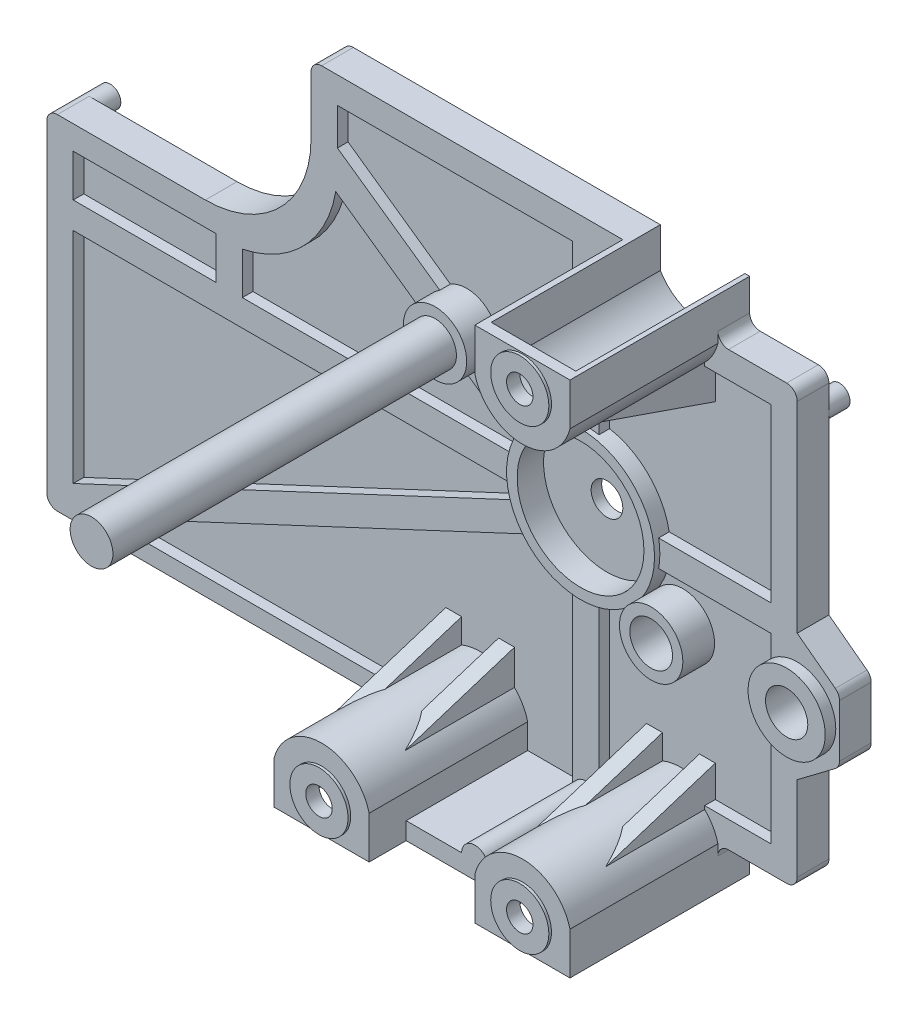
from build123d import *
from build123d.topology import SkipClean

# Parameters (mm, degrees)
SALIENTE_EXTRUIR1_DEPTH     = 3
SALIENTE_EXTRUIR2_DEPTH     = 28
SALIENTE_EXTRUIR3_DEPTH     = 21
CORTAR_EXTRUIR1_START       = -2
CROQUIS7_W                  = 27
CROQUIS7_H                  = 8
CORTAR_EXTRUIR1_DEPTH       = 2
CROQUIS8_R                  = 14
CROQUIS8_R_2                = 12
SALIENTE_EXTRUIR4_DEPTH     = 1
CORTAR_EXTRUIR2_DEPTH       = 39
CORTAR_EXTRUIR2_DEPTH_BACK  = 37
CROQUIS9_R                  = 3
CROQUIS10_R                 = 12
CROQUIS10_R_2               = 3
CORTAR_EXTRUIR3_DEPTH       = 4
SALIENTE_EXTRUIR7_DEPTH     = 1.5
SALIENTE_EXTRUIR8_DEPTH     = 1.5
SALIENTE_EXTRUIR9_DEPTH     = 1.5
SALIENTE_EXTRUIR10_DEPTH    = 1.5
SALIENTE_EXTRUIR11_DEPTH    = 1.5
SALIENTE_EXTRUIR12_DEPTH    = 1.5
CROQUIS22_R                 = 6
CROQUIS22_R_2               = 4.05
SALIENTE_EXTRUIR15_DEPTH    = 6
SALIENTE_EXTRUIR15_2_DEPTH  = 6
CORTAR_EXTRUIR6_DEPTH       = 22
CORTAR_EXTRUIR6_DEPTH_BACK  = 17
CROQUIS23_R                 = 4.05
CROQUIS24_R                 = 5.5
SALIENTE_EXTRUIR16_DEPTH    = 0.5
CROQUIS25_R                 = 2.5
CORTAR_EXTRUIR7_DEPTH       = 40.5
SALIENTE_EXTRUIR17_DEPTH    = 3.282447
CORTAR_EXTRUIR8_DEPTH       = 32
CORTAR_EXTRUIR9_DEPTH       = 32
CORTAR_EXTRUIR10_DEPTH      = 32
SALIENTE_EXTRUIR18_DEPTH    = 4
CROQUIS33_R                 = 0.75
CORTAR_EXTRUIR11_DEPTH      = 4
CROQUIS34_R                 = 2
SALIENTE_EXTRUIR19_DEPTH    = 4
CROQUIS35_R                 = 1
CORTAR_EXTRUIR12_DEPTH      = 3.5
CROQUIS36_R                 = 0.8
SALIENTE_EXTRUIR20_DEPTH    = 0.2
C_PULA1_FACE_RADIUS         = 0.8
C_PULA1_HEIGHT              = 1
CROQUIS39_R                 = 7.3
SALIENTE_EXTRUIR21_DEPTH    = 4
CORTAR_EXTRUIR13_DEPTH      = 26
CORTAR_EXTRUIR13_DEPTH_BACK = 38
CROQUIS40_R                 = 4
CROQUIS42_R                 = 4.05
SALIENTE_EXTRUIR24_DEPTH    = 65


with BuildPart() as part:
    # Croquis3 → Saliente-Extruir1 (new, symmetric)
    with BuildSketch(Plane.XY):
        with BuildLine():
            Line((48.723300971, -56.222087379), (48.723300971, -50.222087379))
            ThreePointArc((48.723300971, -50.222087379), (49.309087409, -48.807873816), (50.723300971, -48.222087379))
            Line((50.723300971, -48.222087379), (61.723300971, -48.222087379))
            ThreePointArc((61.723300971, -48.222087379), (63.137514533, -47.636300941), (63.723300971, -46.222087379))
            Line((63.723300971, -46.222087379), (63.723300971, -30.222087379))
            Line((63.723300971, -30.222087379), (70.926931017, -24.793762782))
            ThreePointArc((70.926931017, -24.793762782), (71.513169694, -24.088887388), (71.723300971, -23.196491762))
            Line((71.723300971, -23.196491762), (71.723300971, -13.247682996))
            ThreePointArc((71.723300971, -13.247682996), (71.513169694, -12.355287369), (70.926931017, -11.650411975))
            Line((70.926931017, -11.650411975), (63.723300971, -6.222087379))
            Line((63.723300971, -6.222087379), (63.723300971, 31.777912621))
            ThreePointArc((63.723300971, 31.777912621), (63.137514533, 33.192126184), (61.723300971, 33.777912621))
            Line((61.723300971, 33.777912621), (50.723300971, 33.777912621))
            ThreePointArc((50.723300971, 33.777912621), (49.309087409, 34.363699059), (48.723300971, 35.777912621))
            Line((48.723300971, 35.777912621), (48.723300971, 41.777912621))
            Line((48.723300971, 41.777912621), (-26.276699029, 41.777912621))
            ThreePointArc((-26.276699029, 41.777912621), (-27.690912591, 41.192126184), (-28.276699029, 39.777912621))
            Line((-28.276699029, 39.777912621), (-28.276699029, 28.777912621))
            ThreePointArc((-28.276699029, 28.777912621), (-34.134563405, 14.635776998), (-48.276699029, 8.777912621))
            Line((-48.276699029, 8.777912621), (-76.276699029, 8.777912621))
            ThreePointArc((-76.276699029, 8.777912621), (-77.690912591, 8.192126184), (-78.276699029, 6.777912621))
            Line((-78.276699029, 6.777912621), (-78.276699029, -54.222087379))
            ThreePointArc((-78.276699029, -54.222087379), (-77.690912591, -55.636300941), (-76.276699029, -56.222087379))
            Line((-76.276699029, -56.222087379), (48.723300971, -56.222087379))
        make_face()
    extrude(amount=SALIENTE_EXTRUIR1_DEPTH, both=True)

    # Croquis4 → Saliente-Extruir2 (add)
    with BuildSketch(Plane.XY.offset(3)):
        with BuildLine():
            Line((30.723300971, 41.777912621), (30.723300971, 33.777912621))
            ThreePointArc((30.723300971, 33.777912621), (39.723300971, 26.76030074), (48.723300971, 33.777912621))
            Line((48.723300971, 33.777912621), (48.723300971, 41.777912621))
            Line((48.723300971, 41.777912621), (30.723300971, 41.777912621))
        make_face()
        with BuildLine():
            Line((48.723300971, -56.222087379), (48.723300971, -48.222087379))
            ThreePointArc((48.723300971, -48.222087379), (39.723300971, -41.204475497), (30.723300971, -48.222087379))
            Line((30.723300971, -48.222087379), (30.723300971, -56.222087379))
            Line((30.723300971, -56.222087379), (48.723300971, -56.222087379))
        make_face()
        with BuildLine():
            Line((10.723300971, -56.222087379), (10.723300971, -48.222087379))
            ThreePointArc((10.723300971, -48.222087379), (1.723300971, -41.204475497), (-7.276699029, -48.222087379))
            Line((-7.276699029, -48.222087379), (-7.276699029, -56.222087379))
            Line((-7.276699029, -56.222087379), (10.723300971, -56.222087379))
        make_face()
    extrude(amount=SALIENTE_EXTRUIR2_DEPTH)

    # Croquis5 → Saliente-Extruir3 (add)
    with BuildSketch(Plane.XY.offset(3)):
        with BuildLine():
            Line((10.723300971, -56.222087379), (10.723300971, -52.939642318))
            Line((10.723300971, -52.939642318), (21.223300971, -52.939642318))
            ThreePointArc((21.223300971, -52.939642318), (23.723300971, -50.439642318), (26.223300971, -52.939642318))
            Line((26.223300971, -52.939642318), (30.723300971, -52.939642318))
            Line((30.723300971, -52.939642318), (30.723300971, -56.222087379))
            Line((30.723300971, -56.222087379), (10.723300971, -56.222087379))
        make_face()
    extrude(amount=SALIENTE_EXTRUIR3_DEPTH)

    # Croquis7 → Cortar-Extruir1 (cut)
    with BuildSketch(Plane.XY.offset(3).offset(CORTAR_EXTRUIR1_START)):
        with BuildLine():
            Line((-73.276699029, -8.722087379), (-73.276699029, -50.179501513))
            Line((-73.276699029, -50.179501513), (10.54826866, -10.956907714))
            ThreePointArc((10.54826866, -10.956907714), (10.202045105, -9.851913796), (9.948323657, -8.722087379))
            Line((9.948323657, -8.722087379), (-73.276699029, -8.722087379))
        make_face()
        with Locations((-59.776699029, 0.277912621)):
            Rectangle(CROQUIS7_W, CROQUIS7_H)
        with BuildLine():
            Line((-23.276699029, 36.777912621), (16.723300971, 36.777912621))
            Line((16.723300971, 36.777912621), (21.223300971, 36.777912621))
            Line((21.223300971, 36.777912621), (21.223300971, 7.552889935))
            ThreePointArc((21.223300971, 7.552889935), (17.239971214, 6.186233832), (13.843272479, 3.696835799))
            Line((13.843272479, 3.696835799), (-23.276699029, 29.796763611))
            Line((-23.276699029, 29.796763611), (-23.276699029, 36.777912621))
        make_face()
        with BuildLine():
            Line((-41.276699029, 4.232504936), (-41.276699029, -3.722087379))
            Line((-41.276699029, -3.722087379), (4.723442905, -3.722087379))
            Line((4.723442905, -3.722087379), (9.948323657, -3.722087379))
            ThreePointArc((9.948323657, -3.722087379), (10.200034776, -2.599757822), (10.543026708, -1.50187866))
            Line((10.543026708, -1.50187866), (-23.595805676, 22.501939894))
            ThreePointArc((-23.595805676, 22.501939894), (-29.60850244, 10.63056719), (-41.276699029, 4.232504936))
        make_face()
        with BuildLine():
            Line((26.223300971, 36.777912621), (26.223300971, 7.552889935))
            ThreePointArc((26.223300971, 7.552889935), (33.622795907, 3.677407558), (37.498278285, -3.722087379))
            Line((37.498278285, -3.722087379), (58.723300971, -3.722087379))
            Line((58.723300971, -3.722087379), (58.723300971, 28.777912621))
            Line((58.723300971, 28.777912621), (45.500507806, 28.777912621))
            ThreePointArc((45.500507806, 28.777912621), (36.748977696, 27.249862693), (30.723300971, 33.777912621))
            Line((30.723300971, 33.777912621), (30.723300971, 36.777912621))
            Line((30.723300971, 36.777912621), (26.223300971, 36.777912621))
        make_face()
        with BuildLine():
            Line((37.498278285, -8.722087379), (58.723300971, -8.722087379))
            Line((58.723300971, -8.722087379), (58.723300971, -43.222087379))
            Line((58.723300971, -43.222087379), (45.500507806, -43.222087379))
            ThreePointArc((45.500507806, -43.222087379), (36.748977696, -41.694037451), (30.723300971, -48.222087379))
            Line((30.723300971, -48.222087379), (30.723300971, -52.939642318))
            Line((30.723300971, -52.939642318), (26.223300971, -52.939642318))
            Line((26.223300971, -52.939642318), (26.223300971, -43.525335216))
            Line((26.223300971, -43.525335216), (26.223300971, -19.997064693))
            ThreePointArc((26.223300971, -19.997064693), (33.622795907, -16.121582315), (37.498278285, -8.722087379))
        make_face()
        with BuildLine():
            Line((21.223300971, -52.939642318), (21.223300971, -19.997064693))
            ThreePointArc((21.223300971, -19.997064693), (16.737476548, -18.354616263), (13.065010864, -15.299578882))
            Line((13.065010864, -15.299578882), (-67.377835865, -52.939642318))
            Line((-67.377835865, -52.939642318), (-7.276699029, -52.939642318))
            Line((-7.276699029, -52.939642318), (-7.276699029, -48.222087379))
            ThreePointArc((-7.276699029, -48.222087379), (1.723300971, -41.204475497), (10.723300971, -48.222087379))
            Line((10.723300971, -48.222087379), (10.723300971, -52.939642318))
            Line((10.723300971, -52.939642318), (21.223300971, -52.939642318))
        make_face()
    extrude(amount=CORTAR_EXTRUIR1_DEPTH, mode=Mode.SUBTRACT)

    # Croquis8 → Saliente-Extruir4 (add)
    with SkipClean():  # the faces are left unmerged after this step: merging them gives an invalid solid
        with BuildSketch(Plane.XY.offset(3)):
            with Locations((23.723300971, -6.222087379)):
                Circle(CROQUIS8_R)
            with Locations((23.723300971, -6.222087379)):
                Circle(CROQUIS8_R_2, mode=Mode.SUBTRACT)
        extrude(amount=SALIENTE_EXTRUIR4_DEPTH)

    # Croquis9 → Cortar-Extruir2 (cut, two sides: drawn at the far end of the back side and taken through both)
    with SkipClean():  # the faces are left unmerged after this step: merging them gives an invalid solid
        with BuildSketch(Plane.XY.offset(3).offset(-CORTAR_EXTRUIR2_DEPTH_BACK)):
            with Locations((23.723300971, -6.222087379)):
                Circle(CROQUIS9_R)
        extrude(amount=CORTAR_EXTRUIR2_DEPTH + CORTAR_EXTRUIR2_DEPTH_BACK, mode=Mode.SUBTRACT)

    # Croquis10 → Cortar-Extruir3 (cut)
    with SkipClean():  # the faces are left unmerged after this step: merging them gives an invalid solid
        with BuildSketch(Plane.XY.offset(3)):
            with Locations((23.723300971, -6.222087379)):
                Circle(CROQUIS10_R)
            with Locations((23.723300971, -6.222087379)):
                Circle(CROQUIS10_R_2, mode=Mode.SUBTRACT)
        extrude(amount=-CORTAR_EXTRUIR3_DEPTH, mode=Mode.SUBTRACT)

    # Croquis15 → Saliente-Extruir7 (add, symmetric)
    with SkipClean():  # the faces are left unmerged after this step: merging them gives an invalid solid
        with BuildSketch(Plane.ZY.offset(3.276699029)):
            Polygon((25.08, -44.936835027), (3, -44.936835027), (0, -44.936835027), (0, -36.936835027), align=None)
        extrude(amount=SALIENTE_EXTRUIR7_DEPTH, both=True)

    # Croquis17 → Saliente-Extruir8 (add, symmetric)
    with SkipClean():  # the faces are left unmerged after this step: merging them gives an invalid solid
        with BuildSketch(Plane(origin=(6.723300971, 0, 0), x_dir=(0, 0, -1), z_dir=(1, 0, 0))):
            Polygon((-1, -43.861153068), (-1, -37.255814293), (-21.707737059, -43.861153068), align=None)
        extrude(amount=SALIENTE_EXTRUIR8_DEPTH, both=True)

    # Croquis18 → Saliente-Extruir9 (add, symmetric)
    with SkipClean():  # the faces are left unmerged after this step: merging them gives an invalid solid
        with BuildSketch(Plane.ZY.offset(-34.723300971)):
            Polygon((1, -37.255814293), (1, -43.861153068), (21.707737059, -43.861153068), align=None)
        extrude(amount=SALIENTE_EXTRUIR9_DEPTH, both=True)

    # Croquis19 → Saliente-Extruir10 (add, symmetric)
    with SkipClean():  # the faces are left unmerged after this step: merging them gives an invalid solid
        with BuildSketch(Plane(origin=(44.723300971, 0, 0), x_dir=(0, 0, -1), z_dir=(1, 0, 0))):
            Polygon((-1, -43.861153068), (-1, -37.255814293), (-21.707737059, -43.861153068), align=None)
        extrude(amount=SALIENTE_EXTRUIR10_DEPTH, both=True)

    # Croquis20 → Saliente-Extruir11 (add, symmetric)
    with SkipClean():  # the faces are left unmerged after this step: merging them gives an invalid solid
        with BuildSketch(Plane.ZY.offset(-34.723300971)):
            Polygon((0, 29.834262637), (0, 21.627777916), (23.680931843, 29.834262637), align=None)
        extrude(amount=SALIENTE_EXTRUIR11_DEPTH, both=True)

    # Croquis21 → Saliente-Extruir12 (add, symmetric)
    with SkipClean():  # the faces are left unmerged after this step: merging them gives an invalid solid
        with BuildSketch(Plane(origin=(44.723300971, 0, 0), x_dir=(0, 0, -1), z_dir=(1, 0, 0))):
            Polygon((-1, 29.416978311), (-22.476800962, 29.416978311), (-1, 21.974321911), align=None)
        extrude(amount=SALIENTE_EXTRUIR12_DEPTH, both=True)

    # Croquis23 → Cortar-Extruir6 (cut, two sides: drawn at the far end of the back side and taken through both)
    with BuildSketch(Plane.XY.offset(1).offset(-CORTAR_EXTRUIR6_DEPTH_BACK)):
        with Locations((-0.817590004, 11.033192108)):
            Circle(CROQUIS23_R)
        with Locations((40.083894954, -17.725607036)):
            Circle(CROQUIS23_R)
    extrude(amount=CORTAR_EXTRUIR6_DEPTH + CORTAR_EXTRUIR6_DEPTH_BACK, mode=Mode.SUBTRACT)

    # Croquis24 → Saliente-Extruir16 (add)
    with BuildSketch(Plane.XY.offset(31)):
        with Locations(Location((1.723300971, -50.484475497, 0), (0, 0, 180))):
            Circle(CROQUIS24_R)
        with Locations(Location((39.723300971, -50.484475497, 0), (0, 0, 180))):
            Circle(CROQUIS24_R)
        with Locations((39.723300971, 36.04030074)):
            Circle(CROQUIS24_R)
    extrude(amount=SALIENTE_EXTRUIR16_DEPTH)

    # Croquis25 → Cortar-Extruir7 (cut)
    with BuildSketch(Plane.XY.offset(31.5)):
        with Locations((1.723300971, -50.484475497)):
            Circle(CROQUIS25_R)
        with Locations((39.723300971, -50.484475497)):
            Circle(CROQUIS25_R)
        with Locations((39.723300971, 36.04030074)):
            Circle(CROQUIS25_R)
    extrude(amount=-CORTAR_EXTRUIR7_DEPTH, mode=Mode.SUBTRACT)

    # Croquis27 → Saliente-Extruir17 (add)
    with BuildSketch(Plane(origin=(0, -56.222087379, 0), x_dir=(-1, 0, 0), z_dir=(0, -1, 0))):
        Polygon((7.276699029, -3), (15.276699029, -3), (7.276699029, -13), align=None)
    extrude(amount=-SALIENTE_EXTRUIR17_DEPTH)

    # Croquis29 → Cortar-Extruir8 (cut)
    with BuildSketch(Plane(origin=(0, 0, -3), x_dir=(-1, 0, 0), z_dir=(0, 0, -1))):
        with BuildLine():
            Line((-47.857764137, -56.222087379), (-47.857764137, -48.722087379))
            ThreePointArc((-47.857764137, -48.722087379), (-39.857764137, -44.154809052), (-31.857764137, -48.722087379))
            Line((-31.857764137, -48.722087379), (-31.857764137, -56.222087379))
            Line((-31.857764137, -56.222087379), (-47.857764137, -56.222087379))
        make_face()
    extrude(amount=-CORTAR_EXTRUIR8_DEPTH, mode=Mode.SUBTRACT)

    # Croquis30 → Cortar-Extruir9 (cut)
    with BuildSketch(Plane(origin=(0, 0, -3), x_dir=(-1, 0, 0), z_dir=(0, 0, -1))):
        with BuildLine():
            Line((-9.853300971, -56.222087379), (-9.853300971, -48.722087379))
            ThreePointArc((-9.853300971, -48.722087379), (-1.853300971, -44.154809052), (6.146699029, -48.722087379))
            Line((6.146699029, -48.722087379), (6.146699029, -56.222087379))
            Line((6.146699029, -56.222087379), (-9.853300971, -56.222087379))
        make_face()
    extrude(amount=-CORTAR_EXTRUIR9_DEPTH, mode=Mode.SUBTRACT)

    # Croquis31 → Cortar-Extruir10 (cut)
    with BuildSketch(Plane(origin=(0, 0, -3), x_dir=(-1, 0, 0), z_dir=(0, 0, -1))):
        with BuildLine():
            Line((-47.823300971, 41.777912621), (-47.823300971, 34.277912621))
            ThreePointArc((-47.823300971, 34.277912621), (-39.823300971, 29.710634294), (-31.823300971, 34.277912621))
            Line((-31.823300971, 34.277912621), (-31.823300971, 41.777912621))
            Line((-31.823300971, 41.777912621), (-47.823300971, 41.777912621))
        make_face()
    extrude(amount=-CORTAR_EXTRUIR10_DEPTH, mode=Mode.SUBTRACT)

    # Croquis32 → Saliente-Extruir18 (add)
    with BuildSketch(Plane(origin=(0, 0, -3), x_dir=(-1, 0, 0), z_dir=(0, 0, -1))):
        with BuildLine():
            Line((9.146699029, -56.222087379), (9.146699029, -51.222087379))
            ThreePointArc((9.146699029, -51.222087379), (9.439592248, -50.514980597), (10.146699029, -50.222087379))
            Line((10.146699029, -50.222087379), (13.646699029, -50.222087379))
            ThreePointArc((13.646699029, -50.222087379), (14.707359201, -49.78274755), (15.146699029, -48.722087379))
            Line((15.146699029, -48.722087379), (15.146699029, -47.222087379))
            ThreePointArc((15.146699029, -47.222087379), (15.439592248, -46.514980597), (16.146699029, -46.222087379))
            Line((16.146699029, -46.222087379), (32.146699029, -46.222087379))
            ThreePointArc((32.146699029, -46.222087379), (32.85380581, -46.514980597), (33.146699029, -47.222087379))
            Line((33.146699029, -47.222087379), (33.146699029, -48.722087379))
            ThreePointArc((33.146699029, -48.722087379), (33.586038857, -49.78274755), (34.646699029, -50.222087379))
            Line((34.646699029, -50.222087379), (38.146699029, -50.222087379))
            ThreePointArc((38.146699029, -50.222087379), (38.85380581, -50.514980597), (39.146699029, -51.222087379))
            Line((39.146699029, -51.222087379), (39.146699029, -56.222087379))
            Line((39.146699029, -56.222087379), (9.146699029, -56.222087379))
        make_face()
    extrude(amount=SALIENTE_EXTRUIR18_DEPTH)

    # Croquis33 → Cortar-Extruir11 (cut)
    with BuildSketch(Plane(origin=(0, 0, -7), x_dir=(-1, 0, 0), z_dir=(0, 0, -1))):
        with Locations((11.146699029, -53.722087379)):
            Circle(CROQUIS33_R)
        with Locations((37.146699029, -53.722087379)):
            Circle(CROQUIS33_R)
    extrude(amount=-CORTAR_EXTRUIR11_DEPTH, mode=Mode.SUBTRACT)

    # Croquis34 → Saliente-Extruir19 (add)
    with SkipClean():  # the faces are left unmerged after this step: merging them gives an invalid solid
        with BuildSketch(Plane(origin=(0, 0, -3), x_dir=(-1, 0, 0), z_dir=(0, 0, -1))):
            with Locations((76.276699029, 6.777912621)):
                Circle(CROQUIS34_R)
            with Locations(Location((-61.723300971, 26.777912621, 0), (0, 0, 180))):
                Circle(CROQUIS34_R)
            with Locations(Location((-61.723300971, -26.222087379, 0), (0, 0, 180))):
                Circle(CROQUIS34_R)
            with BuildLine():
                Line((74.276699029, -54.222087379), (74.276699029, -50.222087379))
                ThreePointArc((74.276699029, -50.222087379), (76.276699029, -48.222087379), (78.276699029, -50.222087379))
                Line((78.276699029, -50.222087379), (78.276699029, -54.222087379))
                ThreePointArc((78.276699029, -54.222087379), (76.276699029, -56.222087379), (74.276699029, -54.222087379))
            make_face()
        extrude(amount=SALIENTE_EXTRUIR19_DEPTH)

    # Croquis35 → Cortar-Extruir12 (cut)
    with SkipClean():  # the faces are left unmerged after this step: merging them gives an invalid solid
        with BuildSketch(Plane(origin=(0, 0, -7), x_dir=(-1, 0, 0), z_dir=(0, 0, -1))):
            with Locations((-61.723300971, 26.777912621)):
                Circle(CROQUIS35_R)
            with Locations((-61.723300971, -26.222087379)):
                Circle(CROQUIS35_R)
            with Locations((76.276699029, 6.777912621)):
                Circle(CROQUIS35_R)
            with Locations((76.276699029, -54.222087379)):
                Circle(CROQUIS35_R)
        extrude(amount=-CORTAR_EXTRUIR12_DEPTH, mode=Mode.SUBTRACT)

    # Croquis36 → Saliente-Extruir20 (add)
    with SkipClean():  # the faces are left unmerged after this step: merging them gives an invalid solid
        with BuildSketch(Plane(origin=(0, 0, -7), x_dir=(-1, 0, 0), z_dir=(0, 0, -1))):
            with Locations((76.276699029, -50.222087379)):
                Circle(CROQUIS36_R)
        extrude(amount=SALIENTE_EXTRUIR20_DEPTH)

    # Cúpula1: a dome of height H over a round flat face of radius A is a cap of a sphere of radius (A * A + H * H) / (2 * H)
    c_pula1_r = (C_PULA1_FACE_RADIUS * C_PULA1_FACE_RADIUS + C_PULA1_HEIGHT * C_PULA1_HEIGHT) / (2 * C_PULA1_HEIGHT)
    c_pula1_base = Plane((-76.276699029, -50.222087379, -7.2), z_dir=(0, 0, -1))
    with Locations(c_pula1_base.offset(C_PULA1_HEIGHT - c_pula1_r)):
        c_pula1_ball = Sphere(c_pula1_r, mode=Mode.PRIVATE)
    add(split(c_pula1_ball, bisect_by=c_pula1_base, keep=Keep.TOP, mode=Mode.PRIVATE))

    # Croquis39 → Saliente-Extruir21 (add)
    with SkipClean():  # the faces are left unmerged after this step: merging them gives an invalid solid
        with BuildSketch(Plane.XY.offset(1)):
            with Locations(Location((63.723300971, -18.222087379, 0), (0, 0, 226.769779211))):
                Circle(CROQUIS39_R)
        extrude(amount=SALIENTE_EXTRUIR21_DEPTH)

    # Croquis40 → Cortar-Extruir13 (cut, two sides: drawn at the far end of the back side and taken through both)
    with SkipClean():  # the faces are left unmerged after this step: merging them gives an invalid solid
        with BuildSketch(Plane.XY.offset(5).offset(-CORTAR_EXTRUIR13_DEPTH_BACK)):
            with Locations((63.723300971, -18.222087379)):
                Circle(CROQUIS40_R)
        extrude(amount=CORTAR_EXTRUIR13_DEPTH + CORTAR_EXTRUIR13_DEPTH_BACK, mode=Mode.SUBTRACT)


with BuildPart() as body_2:
    # Croquis22 → Saliente-Extruir15 (new body)
    with BuildSketch(Plane.XY.offset(1)):
        with Locations((40.083894954, -17.725607036)):
            Circle(CROQUIS22_R)
        with Locations((40.083894954, -17.725607036)):
            Circle(CROQUIS22_R_2, mode=Mode.SUBTRACT)
    extrude(amount=SALIENTE_EXTRUIR15_DEPTH)


with BuildPart() as body_3:
    # Croquis22 → Saliente-Extruir15 2 (new body)
    with BuildSketch(Plane.XY.offset(1)):
        with Locations((-0.817590004, 11.033192108)):
            Circle(CROQUIS22_R)
        with Locations((-0.817590004, 11.033192108)):
            Circle(CROQUIS22_R_2, mode=Mode.SUBTRACT)
    extrude(amount=SALIENTE_EXTRUIR15_2_DEPTH)


    with SkipClean():  # the faces are left unmerged after this step: merging them gives an invalid solid
        add(part.part)  # Saliente-Extruir24 merges part
        # Croquis42 → Saliente-Extruir24 (add)
        with BuildSketch(Plane.XY.offset(7)):
            with Locations((-0.817590004, 11.033192108)):
                Circle(CROQUIS42_R)
        extrude(amount=SALIENTE_EXTRUIR24_DEPTH)


solid = Compound([body_2.part, body_3.part])
